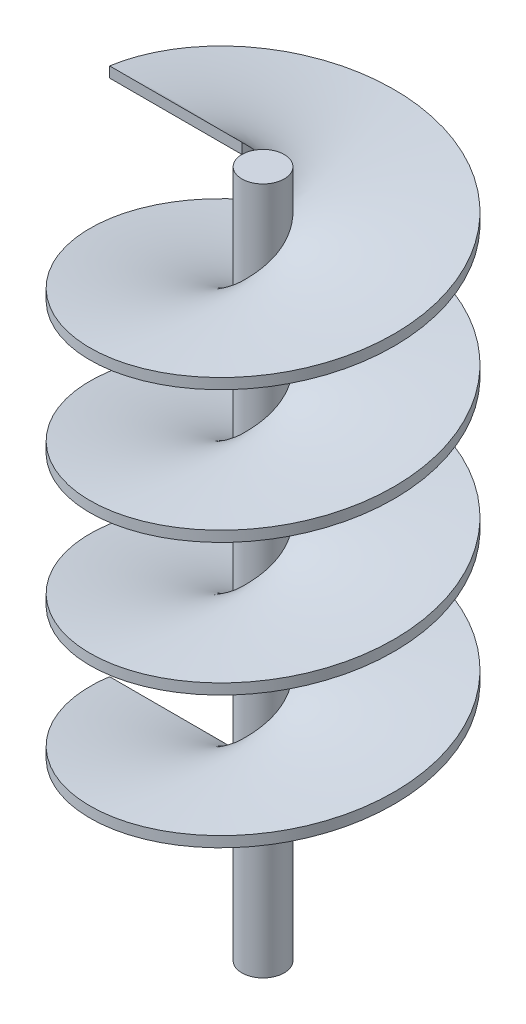
from build123d import *

# Parameters (mm, degrees)
SKETCH1_R           = 4
BOSS_EXTRUDE1_DEPTH = 130
SWEEP1_PITCH        = 25
SWEEP1_HEIGHT       = 100
SWEEP1_RADIUS       = 4
SWEEP1_START_ANGLE  = -90
SKETCH6_W           = 25
SKETCH6_H           = 2


with BuildPart() as part:
    # Sketch1 → Boss-Extrude1 (new body)
    with BuildSketch(Plane(origin=(0, 0, 0), x_dir=(1, 0, 0), z_dir=(0, 1, 0))):
        with Locations(Location((0, 0, 0), (0, 0, 270))):
            Circle(SKETCH1_R)
    extrude(amount=BOSS_EXTRUDE1_DEPTH)

    # Sweep1: sweep along a helix
    with BuildLine() as sweep1_path:
        add(Helix(SWEEP1_PITCH, SWEEP1_HEIGHT, SWEEP1_RADIUS, center=(0, 130, 0), direction=(0, -1, 0), mode=Mode.PRIVATE).rotate(Axis((0, 130, 0), (0, -1, 0)), SWEEP1_START_ANGLE))
    # Sketch6 → Sweep1 (sweep)
    with BuildSketch(Plane(origin=(-4, 130, 0), x_dir=(1, 0, 0), z_dir=(0, 0, 1))):
        with Locations((-12.5, 1)):
            Rectangle(SKETCH6_W, SKETCH6_H)
    sweep(path=sweep1_path.line, is_frenet=True)


solid = part.part
